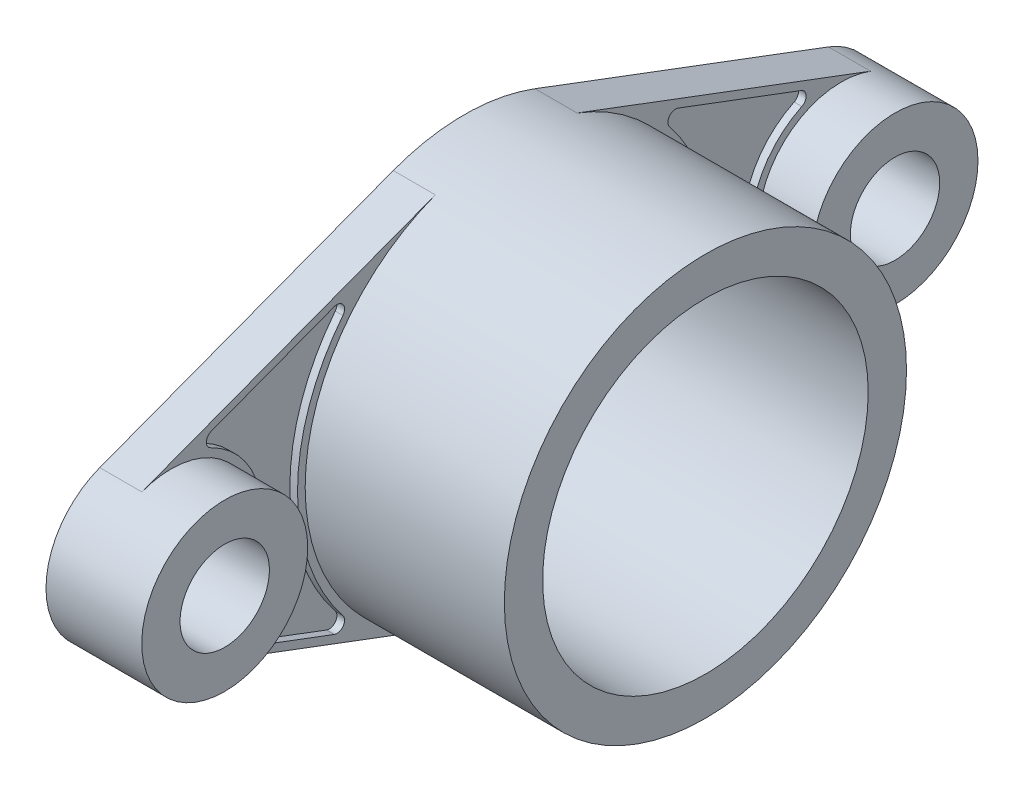
from build123d import *

# Parameters (mm, degrees)
SKETCH1_R             = 52.5
SKETCH1_R_2           = 42.5
BOSS_EXTRUDE1_DEPTH   = 25
SKETCH1_R_3           = 21.666666667
SKETCH1_R_4           = 11.666666667
BOSS_EXTRUDE1_2_DEPTH = 25
BOSS_EXTRUDE1_3_DEPTH = 25
SKETCH2_R             = 52.5
SKETCH2_R_2           = 42.5
BOSS_EXTRUDE2_DEPTH   = 38
BOSS_EXTRUDE3_DEPTH   = 11
CUT_EXTRUDE1_DEPTH    = 2


with BuildPart() as part:
    # Sketch1 → Boss-Extrude1 (new body)
    with BuildSketch(Plane(origin=(0, 0, 0), x_dir=(0, 0, -1), z_dir=(1, 0, 0))):
        Circle(SKETCH1_R)
        Circle(SKETCH1_R_2, mode=Mode.SUBTRACT)
    extrude(amount=BOSS_EXTRUDE1_DEPTH)

    # Sketch2 → Boss-Extrude2 (add)
    with BuildSketch(Plane(origin=(25, 0, 0), x_dir=(0, 0, -1), z_dir=(1, 0, 0))):
        Circle(SKETCH2_R)
        Circle(SKETCH2_R_2, mode=Mode.SUBTRACT)
    extrude(amount=BOSS_EXTRUDE2_DEPTH)



with BuildPart() as body_2:
    # Sketch1 → Boss-Extrude1 2 (new body)
    with BuildSketch(Plane(origin=(0, 0, 0), x_dir=(0, 0, -1), z_dir=(1, 0, 0))):
        with Locations((87.5, 0)):
            Circle(SKETCH1_R_3)
        with Locations((87.5, 0)):
            Circle(SKETCH1_R_4, mode=Mode.SUBTRACT)
    extrude(amount=BOSS_EXTRUDE1_2_DEPTH)


with BuildPart() as body_3:
    # Sketch1 → Boss-Extrude1 3 (new body)
    with BuildSketch(Plane(origin=(0, 0, 0), x_dir=(0, 0, -1), z_dir=(1, 0, 0))):
        with Locations((-87.5, 0)):
            Circle(SKETCH1_R_3)
        with Locations((-87.5, 0)):
            Circle(SKETCH1_R_4, mode=Mode.SUBTRACT)
    extrude(amount=BOSS_EXTRUDE1_3_DEPTH)


with BuildPart() as part_1:
    add(part.part)

    add(body_2.part)  # Boss-Extrude3 merges body 2

    add(body_3.part)  # Boss-Extrude3 merges body 3
    # Sketch4 → Boss-Extrude3 (add)
    with BuildSketch(Plane(origin=(0, 0, 0), x_dir=(0, 0, -1), z_dir=(1, 0, 0))):
        with BuildLine():
            Line((18.5, 49.132473986), (95.134920635, 20.276894026))
            ThreePointArc((95.134920635, 20.276894026), (65.833333333, 0), (95.134920635, -20.276894026))
            Line((95.134920635, -20.276894026), (18.5, -49.132473986))
            ThreePointArc((18.5, -49.132473986), (52.5, 0), (18.5, 49.132473986))
        make_face()
        with BuildLine():
            Line((-95.134920635, -20.276894026), (-18.5, -49.132473986))
            ThreePointArc((-18.5, -49.132473986), (-52.5, 0), (-18.5, 49.132473986))
            Line((-18.5, 49.132473986), (-95.134920635, 20.276894026))
            ThreePointArc((-95.134920635, 20.276894026), (-65.833333333, 0), (-95.134920635, -20.276894026))
        make_face()
    extrude(amount=BOSS_EXTRUDE3_DEPTH)

    # Sketch5 → Cut-Extrude1 (cut)
    with BuildSketch(Plane(origin=(11, 0, 0), x_dir=(0, 0, -1), z_dir=(1, 0, 0))):
        with BuildLine():
            Line((-77.005456237, -24.966157006), (-44.91894061, -37.047790413))
            ThreePointArc((-44.91894061, -37.047790413), (-42.59745711, -36.353451861), (-42.649075034, -33.930906247))
            ThreePointArc((-42.649075034, -33.930906247), (-54.5, 0), (-42.649075034, 33.930906247))
            ThreePointArc((-42.649075034, 33.930906247), (-42.59745711, 36.353451861), (-44.91894061, 37.047790413))
            Line((-44.91894061, 37.047790413), (-77.005456237, 24.966157006))
            ThreePointArc((-77.005456237, 24.966157006), (-78.298605787, 23.185821053), (-77.173367501, 21.294876669))
            ThreePointArc((-77.173367501, 21.294876669), (-63.833333333, 0), (-77.173367501, -21.294876669))
            ThreePointArc((-77.173367501, -21.294876669), (-78.298605787, -23.185821053), (-77.005456237, -24.966157006))
        make_face()
        with BuildLine():
            Line((77.005456237, 24.966157006), (44.91894061, 37.047790413))
            ThreePointArc((44.91894061, 37.047790413), (42.59745711, 36.353451861), (42.649075034, 33.930906247))
            ThreePointArc((42.649075034, 33.930906247), (54.5, 0), (42.649075034, -33.930906247))
            ThreePointArc((42.649075034, -33.930906247), (42.59745711, -36.353451861), (44.91894061, -37.047790413))
            Line((44.91894061, -37.047790413), (77.005456237, -24.966157006))
            ThreePointArc((77.005456237, -24.966157006), (78.298605787, -23.185821053), (77.173367501, -21.294876669))
            ThreePointArc((77.173367501, -21.294876669), (63.833333333, 0), (77.173367501, 21.294876669))
            ThreePointArc((77.173367501, 21.294876669), (78.298605787, 23.185821053), (77.005456237, 24.966157006))
        make_face()
    extrude(amount=-CUT_EXTRUDE1_DEPTH, mode=Mode.SUBTRACT)


solid = part_1.part
